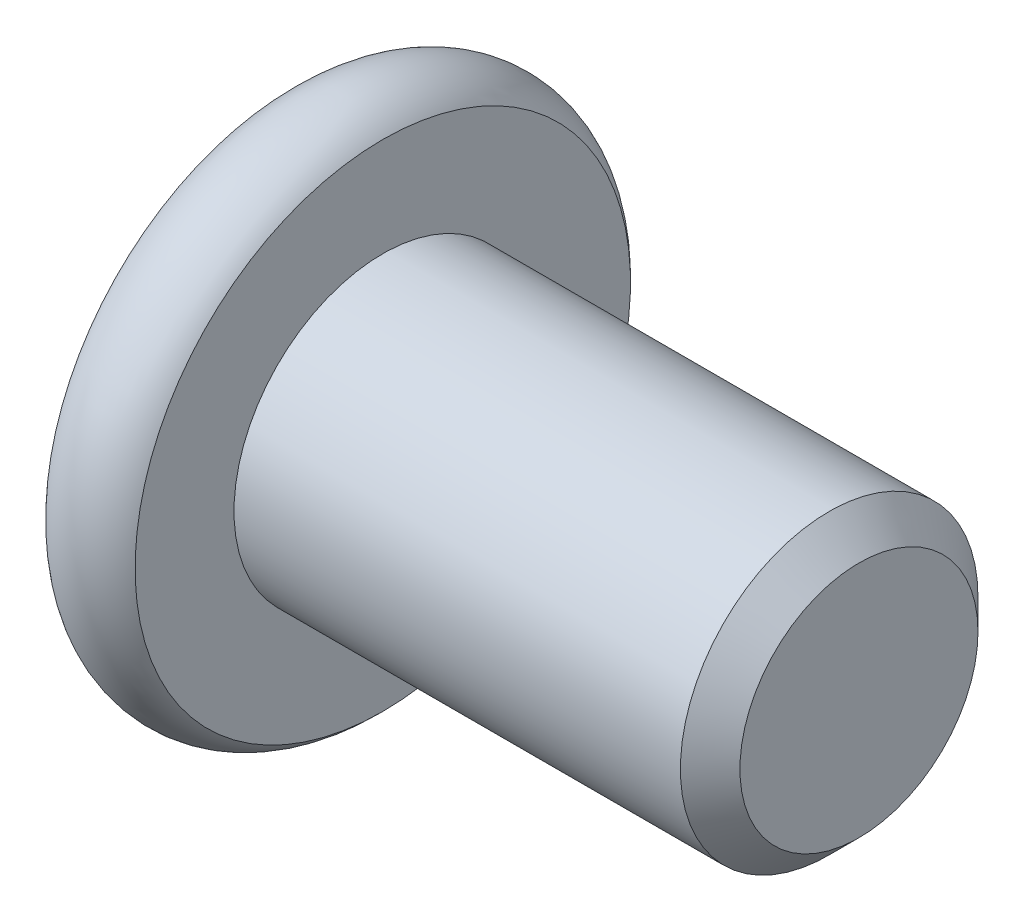
from build123d import *

# Parameters (mm, degrees)
SKETCH2_R           = 2.5
BOSS_EXTRUDE1_DEPTH = 8
CHAMFER1_SIZE       = 0.5
CUT_EXTRUDE1_DEPTH  = 2.3
SKETCH8_R           = 1.782050808
CUT_EXTRUDE2_DEPTH  = 1
CUT_EXTRUDE2_DRAFT  = -45


with BuildPart() as part:
    # Sketch2 → Boss-Extrude1 (new body)
    with BuildSketch(Plane(origin=(0, 0, 0), x_dir=(0, 0, -1), z_dir=(1, 0, 0))):
        Circle(SKETCH2_R)
    extrude(amount=-BOSS_EXTRUDE1_DEPTH)

    # Chamfer1
    chamfer1_edges = [part.edges().sort_by_distance(p)[0] for p in [
        (0, 0, 2.5),
    ]]
    chamfer(chamfer1_edges, length=CHAMFER1_SIZE)

    # Sketch6 → Revolve1 (revolve)
    with BuildSketch(Plane.XY):
        with BuildLine():
            Line((-9.5, 0), (-9.5, 4.161437828))
            ThreePointArc((-9.5, 4.161437828), (-8.75, 4.5), (-8, 4.161437828))
            Line((-8, 4.161437828), (-8, 0))
            Line((-8, 0), (-9.5, 0))
        make_face()
    revolve(axis=Axis((-8, 0, 0), (-1, 0, 0)))

    # Sketch7 → Cut-Extrude1 (cut)
    with BuildSketch(Plane.ZY.offset(9.5)):
        Polygon((0, 1.732050808), (-1.5, 0.866025404), (-1.5, -0.866025404), (0, -1.732050808), (1.5, -0.866025404), (1.5, 0.866025404), align=None)
    extrude(amount=-CUT_EXTRUDE1_DEPTH, mode=Mode.SUBTRACT)


with BuildPart() as cut_extrude2_tool:
    # Sketch8 → Cut-Extrude2 (with draft: the straight prism first)
    with BuildSketch(Plane.ZY.offset(9.5)):
        Circle(SKETCH8_R)
    extrude(amount=-CUT_EXTRUDE2_DEPTH)
    # Cut-Extrude2: the draft: its side faces are tilted about the plane it starts from
    cut_extrude2_sides = [cut_extrude2_tool.faces().sort_by_distance(p)[0] for p in [
        (-9, 0, -1.782050808),
    ]]
    draft(cut_extrude2_sides, Plane.ZY.offset(9.5), CUT_EXTRUDE2_DRAFT)


with BuildPart() as part_1:
    add(part.part)

    # Cut-Extrude2: cut by cut_extrude2_tool
    add(cut_extrude2_tool.part, mode=Mode.SUBTRACT)


solid = part_1.part
